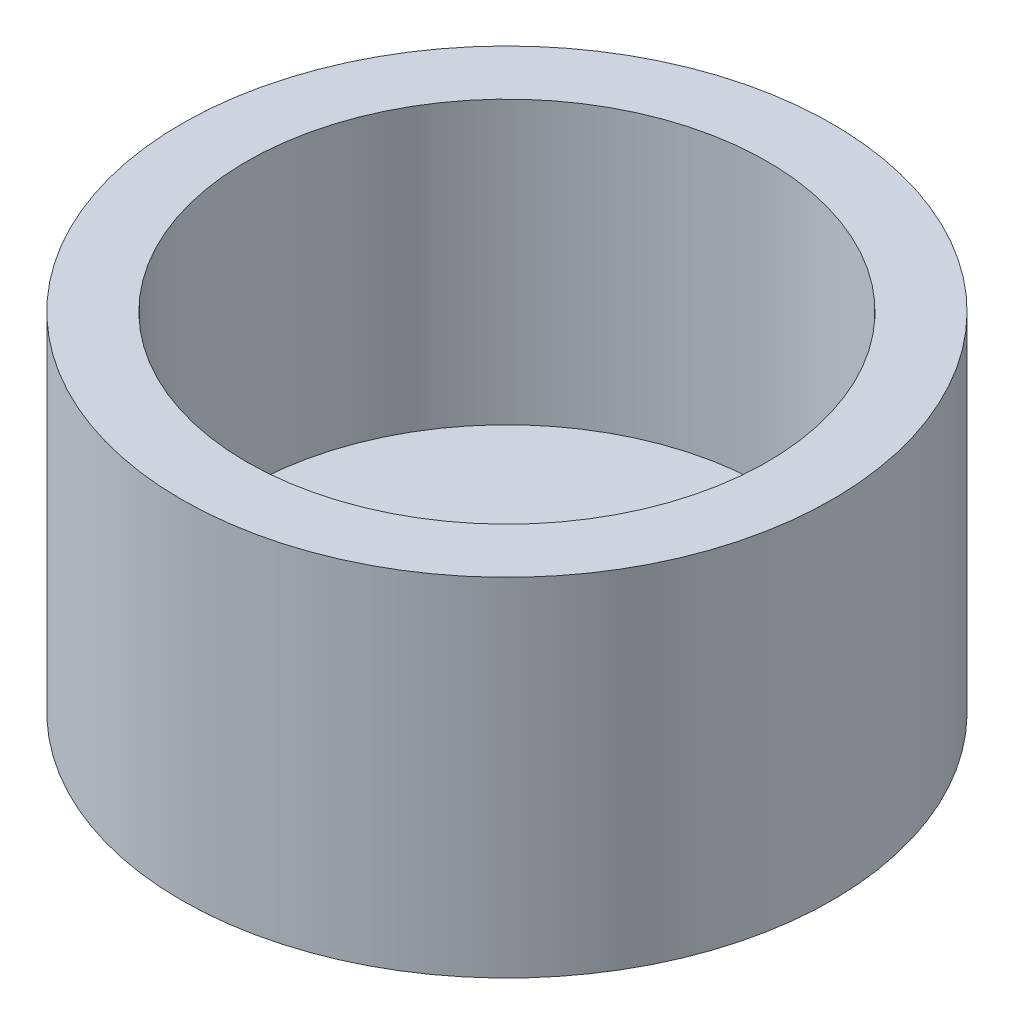
from build123d import *

# Parameters (mm, degrees)
SKETCH1_R           = 75
BOSS_EXTRUDE1_DEPTH = 80
SHELL4_T            = -15


with BuildPart() as part:
    # Sketch1 → Boss-Extrude1 (new body)
    with BuildSketch(Plane(origin=(0, 0, 0), x_dir=(1, 0, 0), z_dir=(0, 1, 0))):
        with Locations(Location((0, 0, 0), (0, 0, 270))):
            Circle(SKETCH1_R)
    extrude(amount=BOSS_EXTRUDE1_DEPTH)

    # Shell4
    shell4_openings = [part.faces().sort_by_distance(p)[0] for p in [
        (0, 80, 0),
    ]]
    offset(amount=SHELL4_T, openings=shell4_openings, kind=Kind.INTERSECTION)


solid = part.part
